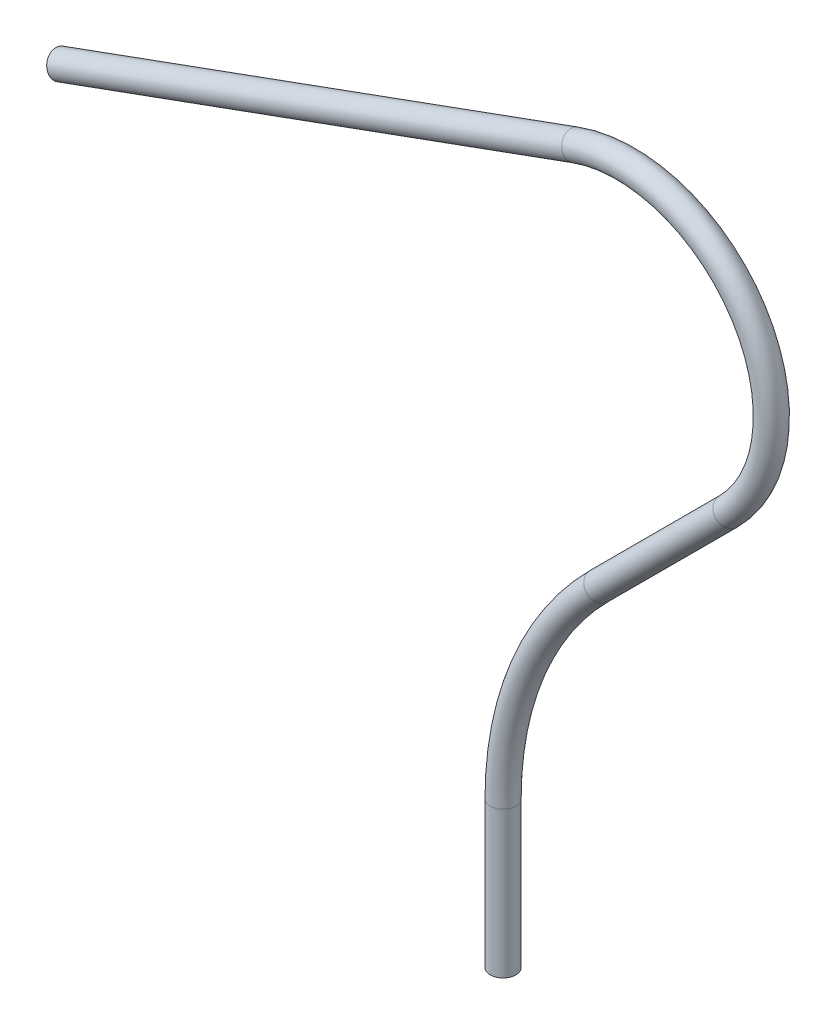
from build123d import *

# Parameters (mm, degrees)
CROQUIS2_R = 3.5


with BuildPart() as part:
    # Barrer1: sweep along a path in Croquis1
    with BuildLine(Plane.XY) as barrer1_path:
        Line((0, 0), (0, 40))
        ThreePointArc((0, 40), (6.850842074, 74.441508913), (26.360389693, 103.639610307))
        Line((26.360389693, 103.639610307), (61.715728753, 138.994949366))
        ThreePointArc((61.715728753, 138.994949366), (67.167115338, 188.771204947), (19.750651772, 204.866925445))
        Line((19.750651772, 204.866925445), (-121.203241346, 153.563903946))
    # Croquis2 → Barrer1 (sweep)
    with BuildSketch(Plane(origin=(0, 0, 0), x_dir=(1, 0, 0), z_dir=(0, 1, 0))):
        Circle(CROQUIS2_R)
    sweep(path=barrer1_path.line)


solid = part.part
